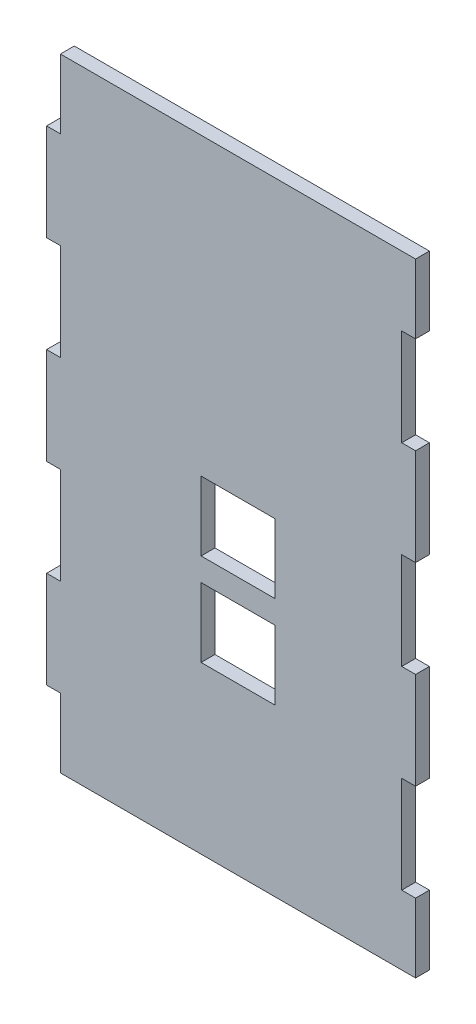
from build123d import *

# Parameters (mm, degrees)
ESBO_O1_W                = 77
ESBO_O1_H                = 135
RESSALTO_EXTRUS_O1_DEPTH = 3
ESBO_O4_W                = 3
ESBO_O4_H                = 21
CORTE_EXTRUS_O1_DEPTH    = 78.765673661
ESBO_O5_W                = 3
ESBO_O5_H                = 21
RESSALTO_EXTRUS_O2_DEPTH = 3
PADR_O_LINEAR1_COUNT     = 3
PADR_O_LINEAR1_PITCH     = 42
ESBO_O6_W                = 16
ESBO_O6_H                = 15
CORTE_EXTRUS_O2_DEPTH    = 80.293757636
PADR_O_LINEAR2_COUNT     = 2
PADR_O_LINEAR2_PITCH     = 20


with BuildPart() as part:
    # Esboço1 → Ressalto-extrusão1 (new body)
    with BuildSketch(Plane.XY):
        Rectangle(ESBO_O1_W, ESBO_O1_H)
    extrude(amount=RESSALTO_EXTRUS_O1_DEPTH)

    # Esboço4 → Corte-extrusão1 (cut, through all)
    with BuildSketch(Plane.XY.offset(3)):
        with Locations((37, 42)):
            Rectangle(ESBO_O4_W, ESBO_O4_H)
        with Locations((37, 0)):
            Rectangle(ESBO_O4_W, ESBO_O4_H)
        with Locations((37, -42)):
            Rectangle(ESBO_O4_W, ESBO_O4_H)
    extrude(amount=-CORTE_EXTRUS_O1_DEPTH, mode=Mode.SUBTRACT)

    # Esboço5 → Ressalto-extrusão2 (add)
    with BuildSketch(Plane.XY.offset(3)):
        with Locations((-40, 42)):
            Rectangle(ESBO_O5_W, ESBO_O5_H)
    ressalto_extrus_o2 = extrude(amount=-RESSALTO_EXTRUS_O2_DEPTH)

    # Padrão linear1: Ressalto-extrusão2 ×3
    with Locations(*[(0, -i * PADR_O_LINEAR1_PITCH, 0) for i in range(1, PADR_O_LINEAR1_COUNT)]):
        add(ressalto_extrus_o2)

    # Esboço6 → Corte-extrusão2 (cut, through all)
    with BuildSketch(Plane.XY.offset(3)):
        with Locations((0, -24)):
            Rectangle(ESBO_O6_W, ESBO_O6_H)
    corte_extrus_o2 = extrude(amount=-CORTE_EXTRUS_O2_DEPTH, mode=Mode.SUBTRACT)

    # Padrão linear2: Corte-extrusão2 ×2
    with Locations(*[(0, i * PADR_O_LINEAR2_PITCH, 0) for i in range(1, PADR_O_LINEAR2_COUNT)]):
        add(corte_extrus_o2, mode=Mode.SUBTRACT)


solid = part.part
